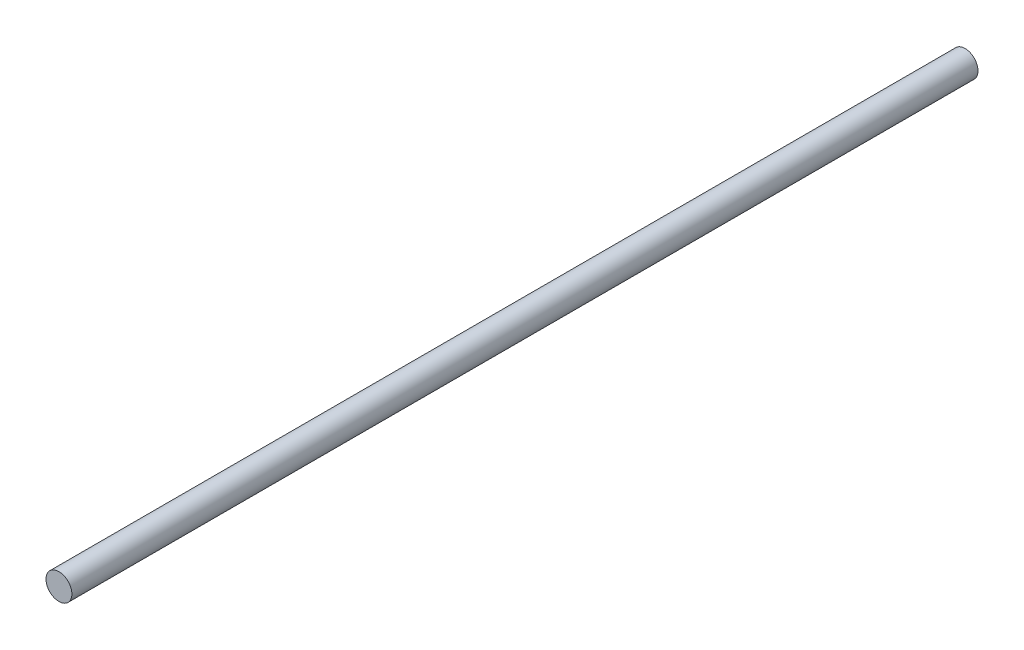
from build123d import *

# Parameters (mm, degrees)
SKETCH_1_W = 4
SKETCH_1_H = 280


with BuildPart() as part:
    # Эскиз1 → Повернуть1 (revolve)
    with BuildSketch(Plane(origin=(0, 0, 0), x_dir=(1, 0, 0), z_dir=(0, 1, 0))):
        with Locations((2, -140)):
            Rectangle(SKETCH_1_W, SKETCH_1_H)
    revolve(axis=Axis((0, 0, 0), (0, 0, 1)))


solid = part.part
